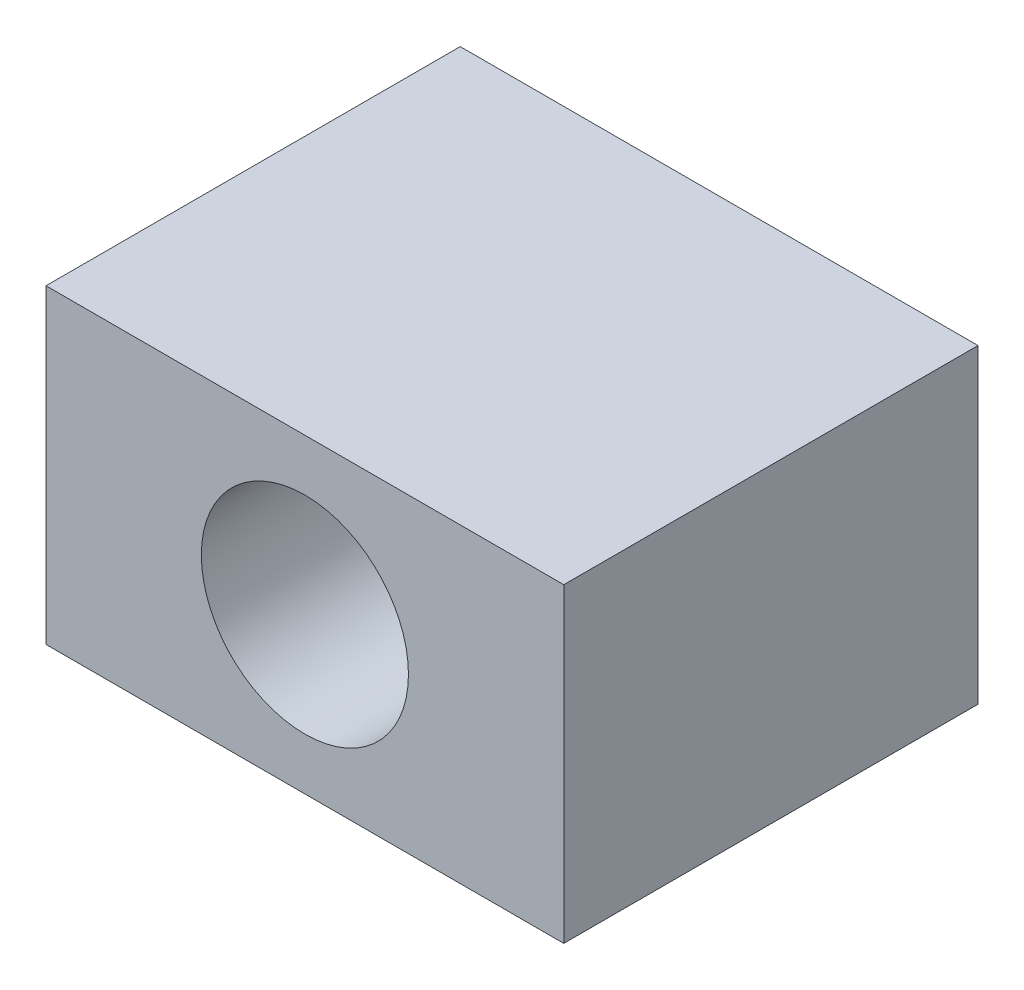
from build123d import *

# Parameters (mm, degrees)
SKETCH2_W           = 5
SKETCH2_H           = 3
BOSS_EXTRUDE1_DEPTH = 4
SKETCH3_R           = 1
CUT_EXTRUDE1_DEPTH  = 3


with BuildPart() as part:
    # Sketch2 → Boss-Extrude1 (new body)
    with BuildSketch(Plane.XY):
        Rectangle(SKETCH2_W, SKETCH2_H)
    extrude(amount=BOSS_EXTRUDE1_DEPTH)

    # Sketch3 → Cut-Extrude1 (cut)
    with BuildSketch(Plane.XY.offset(4)):
        Circle(SKETCH3_R)
    extrude(amount=-CUT_EXTRUDE1_DEPTH, mode=Mode.SUBTRACT)


solid = part.part
